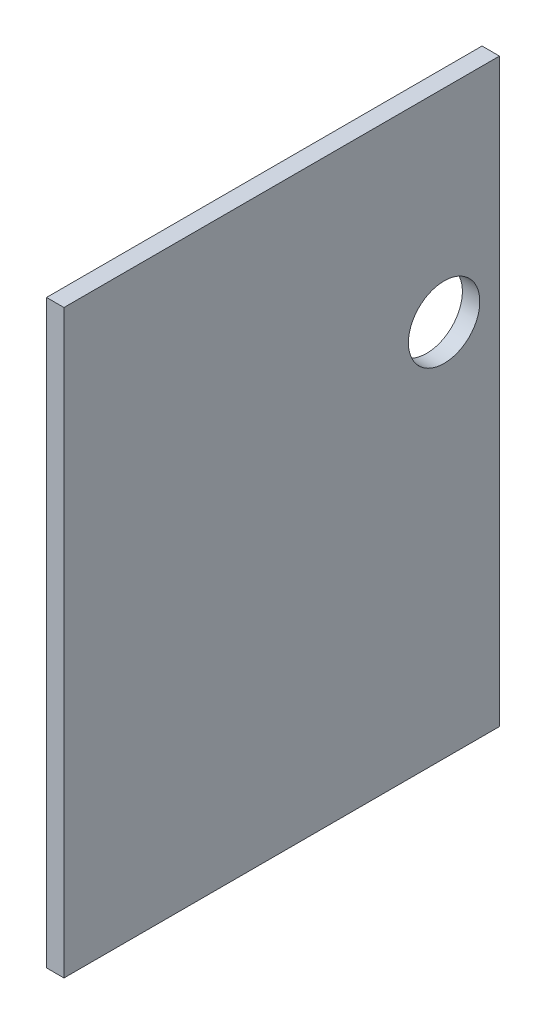
from build123d import *

# Parameters (mm, degrees)
SKETCH1_W           = 190.5
SKETCH1_H           = 254
SKETCH1_R           = 15.621
BOSS_EXTRUDE1_DEPTH = 7.62


with BuildPart() as part:
    # Sketch1 → Boss-Extrude1 (new body)
    with BuildSketch(Plane(origin=(0, 0, 0), x_dir=(0, 0, -1), z_dir=(1, 0, 0))):
        Rectangle(SKETCH1_W, SKETCH1_H)
        with Locations(Location((71.029294729, 38.295087253, 0), (0, 0, 180))):
            Circle(SKETCH1_R, mode=Mode.SUBTRACT)
    extrude(amount=BOSS_EXTRUDE1_DEPTH)


solid = part.part
